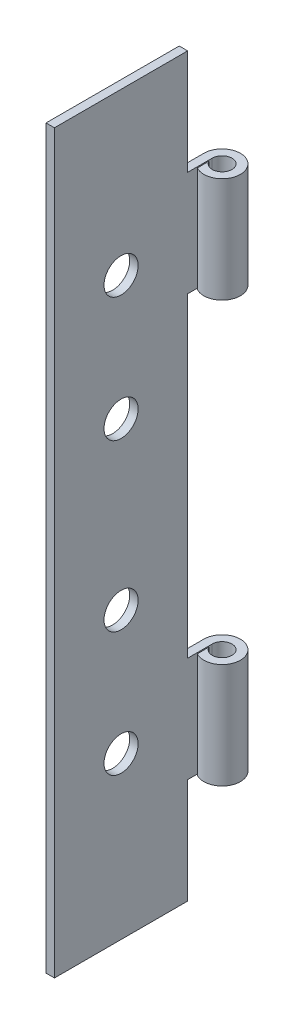
from build123d import *

# Parameters (mm, degrees)
BOSS_EXTRUDE2_DEPTH = 88.9
SKETCH8_W           = 5.93725
SKETCH8_H           = 12.7
CUT_EXTRUDE3_DEPTH  = 92.025212307
SKETCH10_W          = 5.93725
SKETCH10_H          = 12.7
CUT_EXTRUDE4_DEPTH  = 92.025212307
SKETCH16_R          = 2.06
CUT_EXTRUDE6_DEPTH  = 2.54


with BuildPart() as part:
    # Sketch4 → Boss-Extrude2 (new body)
    with BuildSketch(Plane(origin=(0, 0, 0), x_dir=(1, 0, 0), z_dir=(0, 1, 0))):
        with BuildLine():
            Line((0, 0), (0, -19.05))
            Line((0, -19.05), (1.016, -19.05))
            Line((1.016, -19.05), (1.016, 0))
            ThreePointArc((1.016, 0), (3.365064987, 0.274963066), (1.143, -0.535060511))
            Line((1.143, -0.535060511), (1.143, -1.933363843))
            ThreePointArc((1.143, -1.933363843), (4.106126962, 1.122980938), (0, 0))
        make_face()
    extrude(amount=BOSS_EXTRUDE2_DEPTH)

    # Sketch8 → Cut-Extrude3 (cut, through all)
    with BuildSketch(Plane(origin=(0, 0, 0), x_dir=(0, 0, -1), z_dir=(1, 0, 0))):
        with Locations((0, 6.35)):
            Rectangle(SKETCH8_W, SKETCH8_H)
        with Locations((0, 31.75)):
            Rectangle(SKETCH8_W, SKETCH8_H)
        with Locations((0, 57.15)):
            Rectangle(SKETCH8_W, SKETCH8_H)
        with Locations((0, 82.55)):
            Rectangle(SKETCH8_W, SKETCH8_H)
    extrude(amount=CUT_EXTRUDE3_DEPTH, mode=Mode.SUBTRACT)

    # Sketch10 → Cut-Extrude4 (cut, through all)
    with BuildSketch(Plane(origin=(0, 0, 0), x_dir=(0, 0, -1), z_dir=(1, 0, 0))):
        with Locations((0, 44.45)):
            Rectangle(SKETCH10_W, SKETCH10_H)
    extrude(amount=CUT_EXTRUDE4_DEPTH, mode=Mode.SUBTRACT)

    # Sketch16 → Cut-Extrude6 (cut)
    with BuildSketch(Plane.ZY):
        with Locations((11.0093125, 54.45)):
            Circle(SKETCH16_R)
        with Locations((11.0093125, 69.449999972)):
            Circle(SKETCH16_R)
        with Locations((11.0093125, 34.45)):
            Circle(SKETCH16_R)
        with Locations((11.0093125, 19.450000028)):
            Circle(SKETCH16_R)
    extrude(amount=-CUT_EXTRUDE6_DEPTH, mode=Mode.SUBTRACT)


solid = part.part
